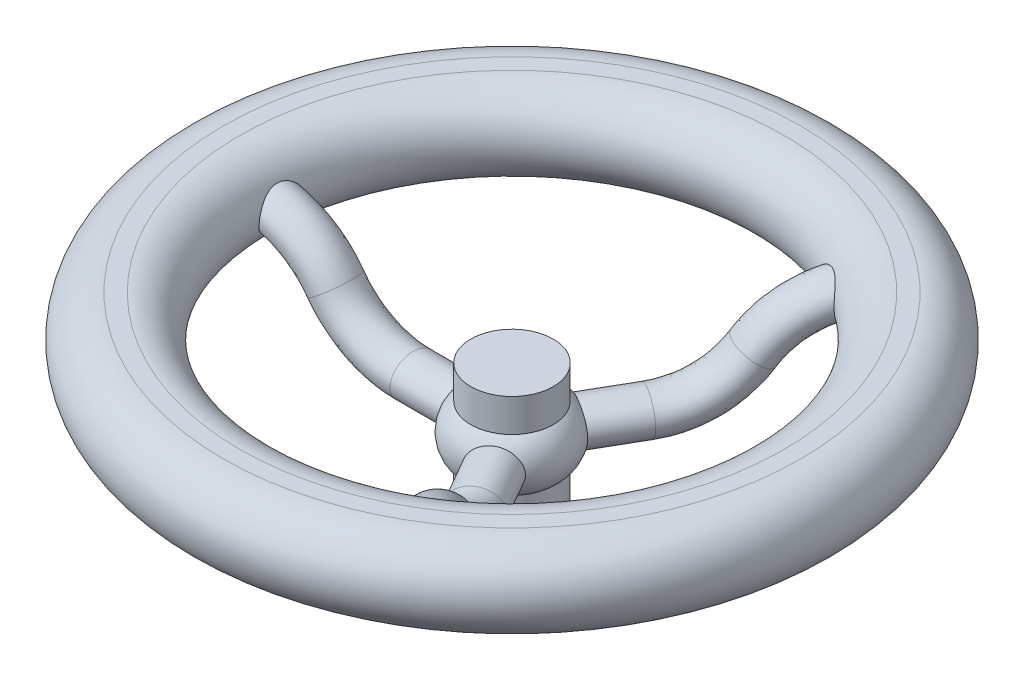
from build123d import *

# Parameters (mm, degrees)
SKETCH_4_RX              = 7
SKETCH_4_RY              = 6
PATTERN_CIRCULAR_1_COUNT = 3


with BuildPart() as part:
    # 스케치1 → 회전1 (revolve)
    with BuildSketch(Plane.XY, mode=Mode.PRIVATE) as revolve_1_sk:
        with BuildLine():
            Line((-12.5, 35), (-12.5, 45))
            Line((-12.5, 45), (0, 45))
            Line((0, 45), (0, 0))
            Line((0, 0), (-12.5, 0))
            Line((-12.5, 0), (-12.5, 19))
            ThreePointArc((-12.5, 19), (-16.5, 27), (-12.5, 35))
        make_face()
    revolve(revolve_1_sk.sketch.rotate(Axis((0, 0, 0), (0, 1, 0)), 270), axis=Axis((0, 0, 0), (0, 1, 0)))



with BuildPart() as body_2:
    # 스케치2 → 회전2 (revolve)
    with BuildSketch(Plane.XY, mode=Mode.PRIVATE) as revolve_2_sk:
        with BuildLine():
            Line((-87.5, 63.5), (-82.5, 63.5))
            ThreePointArc((-82.5, 63.5), (-70, 51), (-82.5, 38.5))
            Line((-82.5, 38.5), (-87.5, 38.5))
            ThreePointArc((-87.5, 38.5), (-100, 51), (-87.5, 63.5))
        make_face()
    revolve(revolve_2_sk.sketch.rotate(Axis((0, 51, 0), (0, 1, 0)), 90), axis=Axis((0, 51, 0), (0, 1, 0)))


with BuildPart() as part_1:
    add(part.part)

    add(body_2.part)  # 스윕1 merges body 2
    # 스윕1: sweep along a path in 스케치3
    with BuildLine(Plane.XY) as sweep_1_path:
        Line((0, 27), (-30, 27))
        ThreePointArc((-30, 27), (-43.190905958, 30.17365686), (-53.494680249, 39))
        ThreePointArc((-53.494680249, 39), (-63.79845454, 47.82634314), (-76.989360498, 51))
        Line((-76.989360498, 51), (-85, 51))
    # 스케치4 → 스윕1 (sweep)
    with BuildSketch(Plane(origin=(0, 0, 0), x_dir=(0, 0, -1), z_dir=(1, 0, 0))):
        with Locations((0, 27)):
            Ellipse(SKETCH_4_RX, SKETCH_4_RY)
    sweep_1 = sweep(path=sweep_1_path.line)

    # 원형 패턴1: 스윕1 ×3 about axis
    pattern_circular_1_axis = Axis((0, 45, 0), (0, -1, 0))
    for i in range(1, PATTERN_CIRCULAR_1_COUNT):
        add(sweep_1.rotate(pattern_circular_1_axis, i * 360 / PATTERN_CIRCULAR_1_COUNT))


solid = part_1.part
